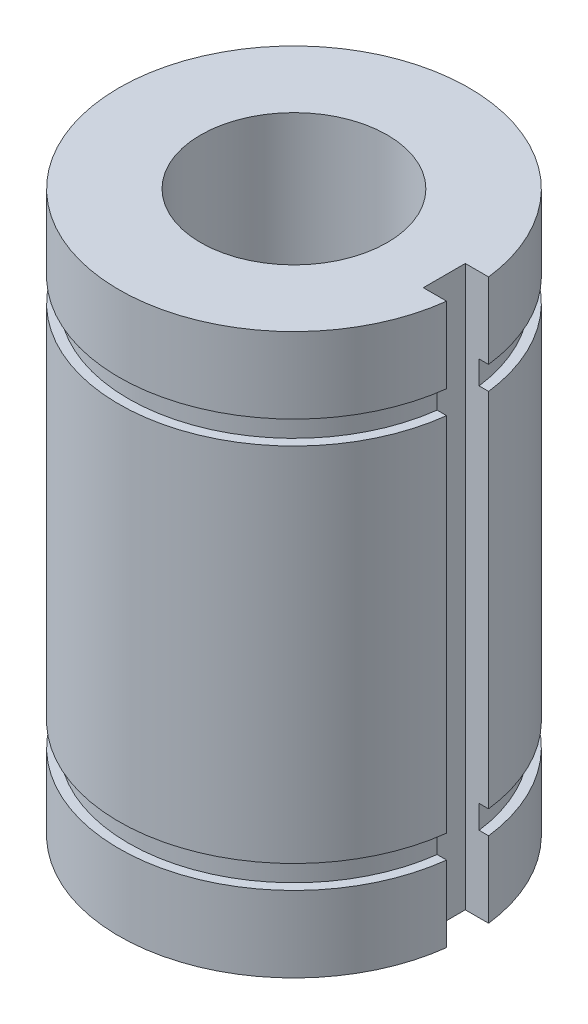
from build123d import *

# Parameters (mm, degrees)
CROQUIS1_R              = 7.5
CROQUIS1_R_2            = 4
SALIENTE_EXTRUIR1_DEPTH = 24
CROQUIS2_W              = 2
CROQUIS2_H              = 1.8
CORTAR_EXTRUIR1_DEPTH   = 27.239283527
CROQUIS3_W              = 1
CROQUIS3_H              = 1


with BuildPart() as part:
    # Croquis1 → Saliente-Extruir1 (new body)
    with BuildSketch(Plane(origin=(0, 0, 0), x_dir=(1, 0, 0), z_dir=(0, 1, 0))):
        with Locations(Location((0, 0, 0), (0, 0, 270))):
            Circle(CROQUIS1_R)
        with Locations(Location((0, 0, 0), (0, 0, 270))):
            Circle(CROQUIS1_R_2, mode=Mode.SUBTRACT)
    extrude(amount=SALIENTE_EXTRUIR1_DEPTH)

    # Croquis2 → Cortar-Extruir1 (cut, through all)
    with BuildSketch(Plane.XZ):
        with Locations((7.445804188, 0)):
            Rectangle(CROQUIS2_W, CROQUIS2_H)
    extrude(amount=-CORTAR_EXTRUIR1_DEPTH, mode=Mode.SUBTRACT)

    # Cortar-Barrer3: sweep along a curve in space
    with BuildLine() as cortar_barrer3_path:
        ThreePointArc((0, 24, 4), (2.828427125, 24, 2.828427125), (4, 24, 0))
        ThreePointArc((4, 24, 0), (2.828427125, 24, -2.828427125), (0, 24, -4))
        ThreePointArc((0, 24, -4), (-2.828427125, 24, -2.828427125), (-4, 24, 0))
        ThreePointArc((-4, 24, 0), (-2.828427125, 24, 2.828427125), (0, 24, 4))
    # Croquis3 → Cortar-Barrer3 (sweep, cut)
    with BuildSketch(Plane.XY):
        with Locations((7.595804188, 20.25)):
            Rectangle(CROQUIS3_W, CROQUIS3_H)
        with Locations((7.595804188, 3.75)):
            Rectangle(CROQUIS3_W, CROQUIS3_H)
        with Locations((-7.595804188, 3.75)):
            Rectangle(CROQUIS3_W, CROQUIS3_H)
        with Locations((-7.595804188, 20.25)):
            Rectangle(CROQUIS3_W, CROQUIS3_H)
    sweep(path=cortar_barrer3_path.line, mode=Mode.SUBTRACT)


solid = part.part
